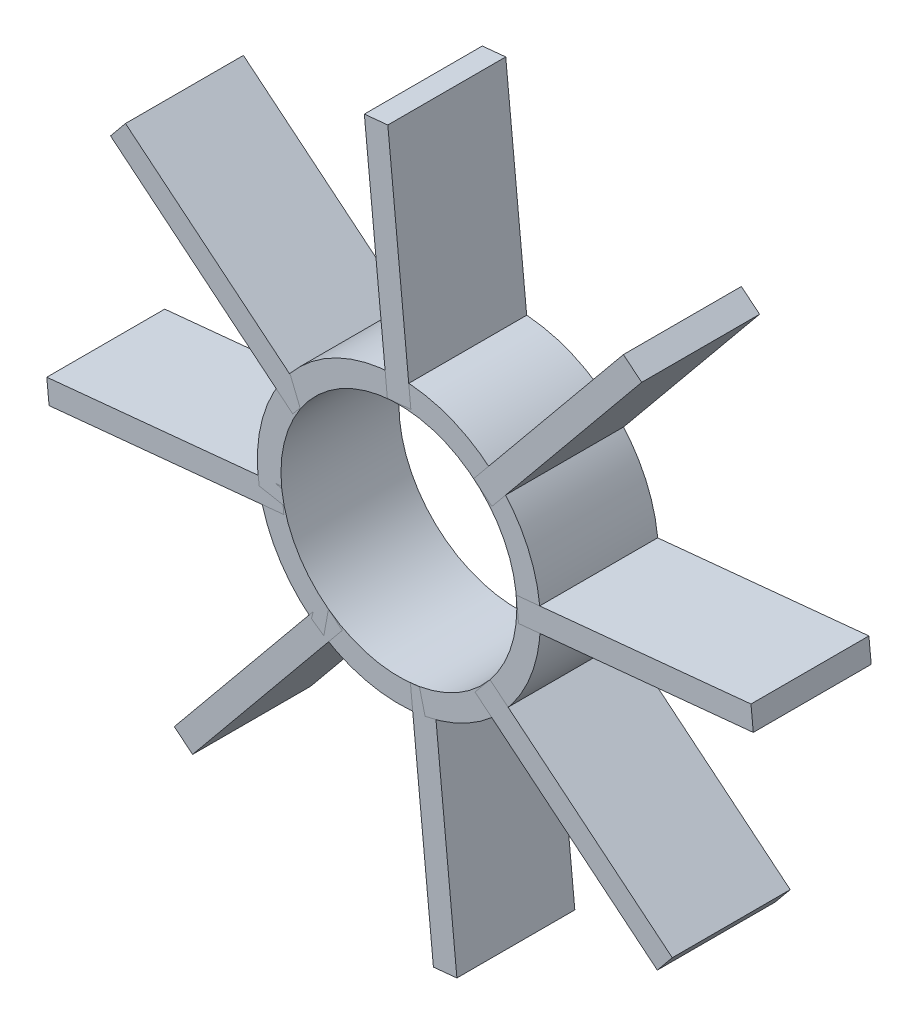
from build123d import *

# Parameters (mm, degrees)
SKETCH1_R             = 60
SKETCH1_R_2           = 50
EXTRUDE_THIN1_DEPTH   = 50
EXTRUDE_THIN1_2_DEPTH = 50
EXTRUDE_THIN1_3_DEPTH = 50
EXTRUDE_THIN1_4_DEPTH = 50
EXTRUDE_THIN1_5_DEPTH = 50
EXTRUDE_THIN1_6_DEPTH = 50
EXTRUDE_THIN1_7_DEPTH = 50
EXTRUDE_THIN1_8_DEPTH = 50
EXTRUDE_THIN1_9_DEPTH = 50


with BuildPart() as part:
    # Sketch1 → Extrude-Thin1 (new body)
    with BuildSketch(Plane.XY):
        Circle(SKETCH1_R)
        Circle(SKETCH1_R_2, mode=Mode.SUBTRACT)
    extrude(amount=EXTRUDE_THIN1_DEPTH)


with BuildPart() as body_2:
    # Sketch1 → Extrude-Thin1 2 (new body)
    with BuildSketch(Plane.XY):
        Polygon((-149.283436585, -14.644301329), (-49.761145528, -4.881433776), (-48.784858773, -14.833662882), (-148.30714983, -24.596530434), align=None)
    extrude(amount=EXTRUDE_THIN1_2_DEPTH)


with BuildPart() as body_3:
    # Sketch1 → Extrude-Thin1 3 (new body)
    with BuildSketch(Plane.XY):
        Polygon((14.644301329, -149.283436585), (4.881433776, -49.761145528), (14.833662882, -48.784858773), (24.596530434, -148.30714983), align=None)
    extrude(amount=EXTRUDE_THIN1_3_DEPTH)


with BuildPart() as body_4:
    # Sketch1 → Extrude-Thin1 4 (new body)
    with BuildSketch(Plane.XY):
        Polygon((-115.914415103, 95.204245553), (-38.638138368, 31.734748518), (-44.985088071, 24.007120844), (-122.261364807, 87.476617879), align=None)
    extrude(amount=EXTRUDE_THIN1_4_DEPTH)


with BuildPart() as body_5:
    # Sketch1 → Extrude-Thin1 5 (new body)
    with BuildSketch(Plane.XY):
        Polygon((-95.204245553, -115.914415103), (-31.734748518, -38.638138368), (-24.007120844, -44.985088071), (-87.476617879, -122.261364807), align=None)
    extrude(amount=EXTRUDE_THIN1_5_DEPTH)


with BuildPart() as body_6:
    # Sketch1 → Extrude-Thin1 6 (new body)
    with BuildSketch(Plane.XY):
        Polygon((-4.881433776, 49.761145528), (-14.644301329, 149.283436585), (-4.692072223, 150.25972334), (5.070795329, 50.737432284), align=None)
    extrude(amount=EXTRUDE_THIN1_6_DEPTH)


with BuildPart() as body_7:
    # Sketch1 → Extrude-Thin1 7 (new body)
    with BuildSketch(Plane.XY):
        Polygon((31.734748518, 38.638138368), (95.204245553, 115.914415103), (102.931873226, 109.5674654), (39.462376191, 32.291188664), align=None)
    extrude(amount=EXTRUDE_THIN1_7_DEPTH)


with BuildPart() as body_8:
    # Sketch1 → Extrude-Thin1 8 (new body)
    with BuildSketch(Plane.XY):
        Polygon((49.761145528, 4.881433776), (149.283436585, 14.644301329), (150.25972334, 4.692072223), (50.737432284, -5.070795329), align=None)
    extrude(amount=EXTRUDE_THIN1_8_DEPTH)


with BuildPart() as body_9:
    # Sketch1 → Extrude-Thin1 9 (new body)
    with BuildSketch(Plane.XY):
        Polygon((38.638138368, -31.734748518), (115.914415103, -95.204245553), (109.5674654, -102.931873226), (32.291188664, -39.462376191), align=None)
    extrude(amount=EXTRUDE_THIN1_9_DEPTH)


solid = Compound([part.part, body_2.part, body_3.part, body_4.part, body_5.part, body_6.part, body_7.part, body_8.part, body_9.part])
